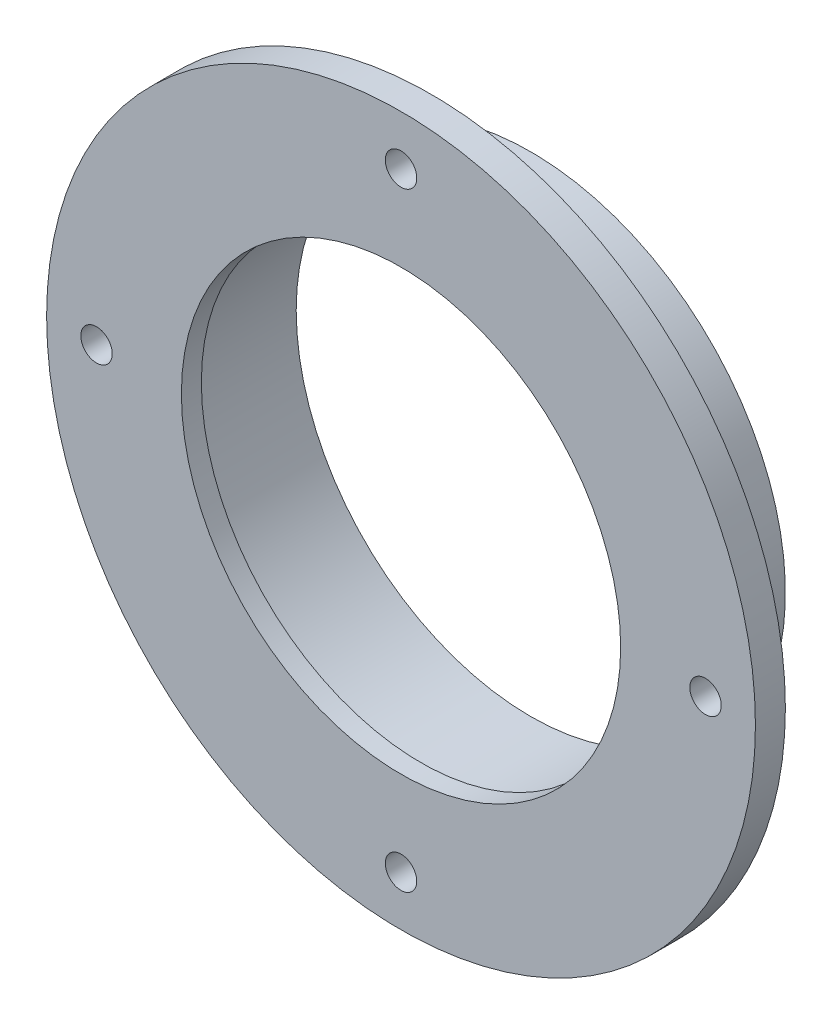
from build123d import *

# Parameters (mm, degrees)
SKETCH_1_R          = 25.5
EXTRUDE_1_DEPTH     = 13
SKETCH_2_R          = 23.5
CUT_EXTRUDE_1_DEPTH = 11
SKETCH_3_R          = 22
CUT_EXTRUDE_2_DEPTH = 2
EXTRUDE_START       = -3
SKETCH_4_R          = 35.5
SKETCH_4_R_2        = 25.5
EXTRUDE_2_DEPTH     = 3
SKETCH_5_R          = 1.575
CUT_EXTRUDE_3_DEPTH = 52.860389509


with BuildPart() as part:
    # 草图1 → 凸台-拉伸1 (new body)
    with BuildSketch(Plane.XY):
        with Locations(Location((0, 0, 0), (0, 0, 180))):
            Circle(SKETCH_1_R)
    extrude(amount=EXTRUDE_1_DEPTH)

    # 草图2 → 切除-拉伸1 (cut)
    with BuildSketch(Plane(origin=(0, 0, 0), x_dir=(-1, 0, 0), z_dir=(0, 0, -1))):
        Circle(SKETCH_2_R)
    extrude(amount=-CUT_EXTRUDE_1_DEPTH, mode=Mode.SUBTRACT)

    # 草图3 → 切除-拉伸2 (cut)
    with BuildSketch(Plane.XY.offset(13)):
        Circle(SKETCH_3_R)
    extrude(amount=-CUT_EXTRUDE_2_DEPTH, mode=Mode.SUBTRACT)

    # 草图4 → 凸台-拉伸2 (add)
    with BuildSketch(Plane.XY.offset(13).offset(EXTRUDE_START)):
        Circle(SKETCH_4_R)
        with Locations(Location((0, 0, 0), (0, 0, 180))):
            Circle(SKETCH_4_R_2, mode=Mode.SUBTRACT)
    extrude(amount=EXTRUDE_2_DEPTH)

    # 草图5 → 切除-拉伸3 (cut, through all)
    with BuildSketch(Plane.XY.offset(13)):
        with Locations((0, 30.5)):
            Circle(SKETCH_5_R)
        with Locations((30.5, 0)):
            Circle(SKETCH_5_R)
        with Locations((0, -30.5)):
            Circle(SKETCH_5_R)
        with Locations((-30.5, 0)):
            Circle(SKETCH_5_R)
    extrude(amount=-CUT_EXTRUDE_3_DEPTH, mode=Mode.SUBTRACT)


solid = part.part
